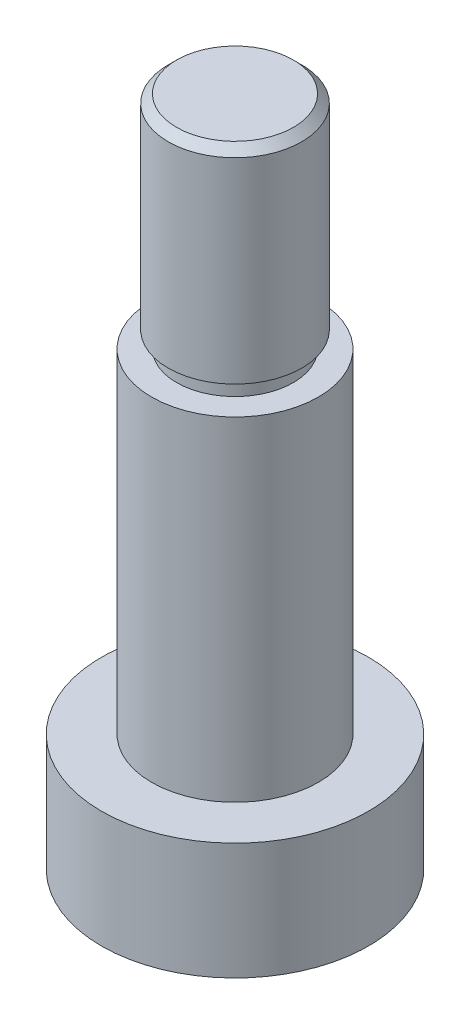
from build123d import *

# Parameters (mm, degrees)
SKETCH_2_R          = 5
EXTRUDE_1_DEPTH     = 20
SKETCH_3_R          = 8
EXTRUDE_2_DEPTH     = 7
SKETCH_4_R          = 4
EXTRUDE_3_DEPTH     = 13.25
CUT_EXTRUDE_1_DEPTH = 3
CHAMFER_1_SIZE      = 0.5
SKETCH_6_R          = 4
SKETCH_6_R_2        = 3.5
CUT_EXTRUDE_2_DEPTH = 1


with BuildPart() as part:
    # 草图2 → 凸台-拉伸1 (new body)
    with BuildSketch(Plane(origin=(0, 0, 0), x_dir=(1, 0, 0), z_dir=(0, 1, 0))):
        with Locations(Location((0, 0, 0), (0, 0, 270))):
            Circle(SKETCH_2_R)
    extrude(amount=EXTRUDE_1_DEPTH)

    # 草图3 → 凸台-拉伸2 (add)
    with BuildSketch(Plane.XZ):
        with Locations(Location((0, 0, 0), (0, 0, 270))):
            Circle(SKETCH_3_R)
    extrude(amount=EXTRUDE_2_DEPTH)

    # 草图4 → 凸台-拉伸3 (add)
    with BuildSketch(Plane(origin=(0, 20, 0), x_dir=(1, 0, 0), z_dir=(0, 1, 0))):
        with Locations(Location((0, 0, 0), (0, 0, 270))):
            Circle(SKETCH_4_R)
    extrude(amount=EXTRUDE_3_DEPTH)

    # 草图5 → 切除-拉伸1 (cut)
    with BuildSketch(Plane.XZ.offset(7)):
        Polygon((0.295951976, 5.999509568), (-5.047751708, 3.256056713), (-5.343703684, -2.743452854), (-0.295951976, -5.999509568), (5.047751708, -3.256056713), (5.343703684, 2.743452854), align=None)
    extrude(amount=-CUT_EXTRUDE_1_DEPTH, mode=Mode.SUBTRACT)

    # 倒角1
    chamfer_1_edges = [part.edges().sort_by_distance(p)[0] for p in [
        (0, 33.25, -4),
    ]]
    chamfer(chamfer_1_edges, length=CHAMFER_1_SIZE)

    # 草图6 → 切除-拉伸2 (cut)
    with BuildSketch(Plane(origin=(0, 20, 0), x_dir=(1, 0, 0), z_dir=(0, 1, 0))):
        with Locations(Location((0, 0, 0), (0, 0, 270))):
            Circle(SKETCH_6_R)
        with Locations(Location((0, 0, 0), (0, 0, 270))):
            Circle(SKETCH_6_R_2, mode=Mode.SUBTRACT)
    extrude(amount=CUT_EXTRUDE_2_DEPTH, mode=Mode.SUBTRACT)


solid = part.part
